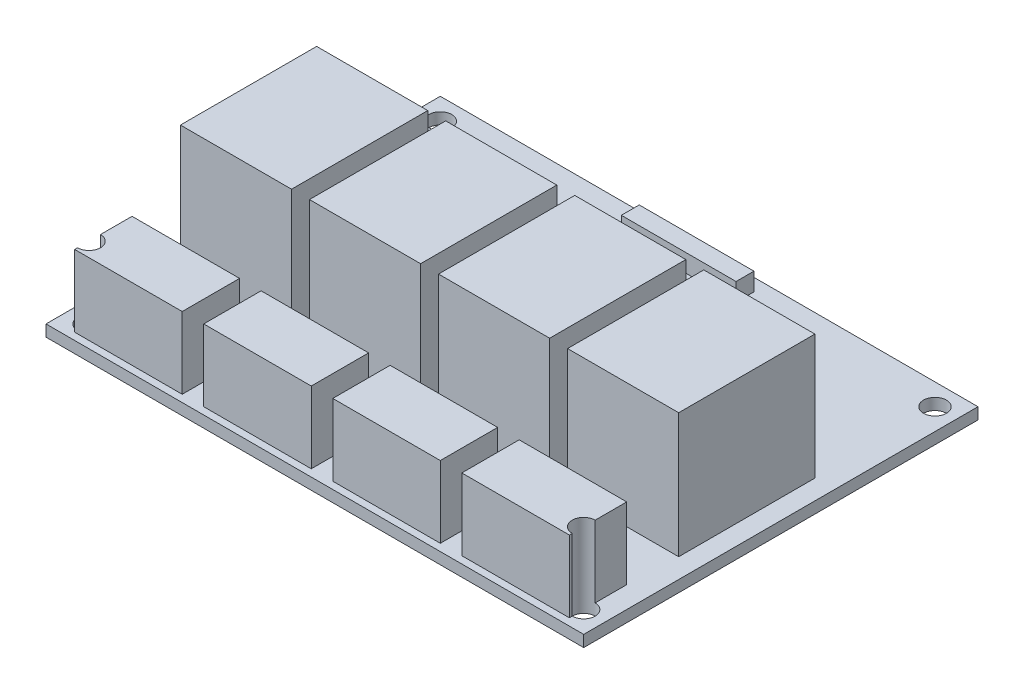
from build123d import *

# Parameters (mm, degrees)
SKETCH1_W              = 75
SKETCH1_H              = 55
PCB_DEPTH              = 1.6
RELAY_1_START          = 1.6
SKETCH2_W              = 15.5
SKETCH2_H              = 19
RELAY_1_DEPTH          = 17.4
TERMINAL_1_START       = 1.6
SKETCH3_W              = 15
SKETCH3_H              = 8
TERMINAL_1_DEPTH       = 10
RELAY_2_START          = 1.6
SKETCH4_W              = 15.5
SKETCH4_H              = 19
RELAY_2_DEPTH          = 17.4
TERMINAL_2_START       = 1.6
SKETCH5_W              = 15
SKETCH5_H              = 8
TERMINAL_2_DEPTH       = 10
RELAY_3_START          = 1.6
SKETCH6_W              = 15.5
SKETCH6_H              = 19
RELAY_3_DEPTH          = 17.4
TERMINAL_3_START       = 1.6
SKETCH7_W              = 15
SKETCH7_H              = 8
TERMINAL_3_DEPTH       = 10
RELAY_4_START          = 1.6
SKETCH8_W              = 15.5
SKETCH8_H              = 19
RELAY_4_DEPTH          = 17.4
TERMINAL_4_START       = 1.6
SKETCH9_W              = 15
SKETCH9_H              = 8
TERMINAL_4_DEPTH       = 10
HEADER_START           = 1.6
SKETCH10_W             = 16
SKETCH10_H             = 2.5
HEADER_DEPTH           = 2.5
MOUNT_HOLES_DEPTH      = 51.23445033
MOUNT_HOLES_DEPTH_BACK = 51.23445033
SKETCH11_R             = 1.6


with BuildPart() as part:
    # Sketch1 → PCB (new body)
    with BuildSketch(Plane(origin=(0, 0, 0), x_dir=(1, 0, 0), z_dir=(0, 1, 0))):
        Rectangle(SKETCH1_W, SKETCH1_H)
    extrude(amount=PCB_DEPTH)

    # Sketch2 → Relay_1 (add)
    with BuildSketch(Plane(origin=(0, 0, 0), x_dir=(1, 0, 0), z_dir=(0, 1, 0)).offset(RELAY_1_START)):
        with Locations((-27, -2)):
            Rectangle(SKETCH2_W, SKETCH2_H)
    extrude(amount=RELAY_1_DEPTH)

    # Sketch3 → Terminal_1 (add)
    with BuildSketch(Plane(origin=(0, 0, 0), x_dir=(1, 0, 0), z_dir=(0, 1, 0)).offset(TERMINAL_1_START)):
        with Locations((-27, -22.5)):
            Rectangle(SKETCH3_W, SKETCH3_H)
    extrude(amount=TERMINAL_1_DEPTH)

    # Sketch4 → Relay_2 (add)
    with BuildSketch(Plane(origin=(0, 0, 0), x_dir=(1, 0, 0), z_dir=(0, 1, 0)).offset(RELAY_2_START)):
        with Locations((-9, -2)):
            Rectangle(SKETCH4_W, SKETCH4_H)
    extrude(amount=RELAY_2_DEPTH)

    # Sketch5 → Terminal_2 (add)
    with BuildSketch(Plane(origin=(0, 0, 0), x_dir=(1, 0, 0), z_dir=(0, 1, 0)).offset(TERMINAL_2_START)):
        with Locations((-9, -22.5)):
            Rectangle(SKETCH5_W, SKETCH5_H)
    extrude(amount=TERMINAL_2_DEPTH)

    # Sketch6 → Relay_3 (add)
    with BuildSketch(Plane(origin=(0, 0, 0), x_dir=(1, 0, 0), z_dir=(0, 1, 0)).offset(RELAY_3_START)):
        with Locations((9, -2)):
            Rectangle(SKETCH6_W, SKETCH6_H)
    extrude(amount=RELAY_3_DEPTH)

    # Sketch7 → Terminal_3 (add)
    with BuildSketch(Plane(origin=(0, 0, 0), x_dir=(1, 0, 0), z_dir=(0, 1, 0)).offset(TERMINAL_3_START)):
        with Locations((9, -22.5)):
            Rectangle(SKETCH7_W, SKETCH7_H)
    extrude(amount=TERMINAL_3_DEPTH)

    # Sketch8 → Relay_4 (add)
    with BuildSketch(Plane(origin=(0, 0, 0), x_dir=(1, 0, 0), z_dir=(0, 1, 0)).offset(RELAY_4_START)):
        with Locations((27, -2)):
            Rectangle(SKETCH8_W, SKETCH8_H)
    extrude(amount=RELAY_4_DEPTH)

    # Sketch9 → Terminal_4 (add)
    with BuildSketch(Plane(origin=(0, 0, 0), x_dir=(1, 0, 0), z_dir=(0, 1, 0)).offset(TERMINAL_4_START)):
        with Locations((27, -22.5)):
            Rectangle(SKETCH9_W, SKETCH9_H)
    extrude(amount=TERMINAL_4_DEPTH)

    # Sketch10 → Header (add)
    with BuildSketch(Plane(origin=(0, 0, 0), x_dir=(1, 0, 0), z_dir=(0, 1, 0)).offset(HEADER_START)):
        with Locations((0, 24.5)):
            Rectangle(SKETCH10_W, SKETCH10_H)
    extrude(amount=HEADER_DEPTH)

    # Sketch11 → Mount_Holes (cut, two sides: drawn at the far end of the back side and taken through both)
    with BuildSketch(Plane(origin=(0, 0, 0), x_dir=(1, 0, 0), z_dir=(0, 1, 0)).offset(-MOUNT_HOLES_DEPTH_BACK)):
        with Locations(Location((-34.5, 24.5, 0), (0, 0, 90))):
            Circle(SKETCH11_R)
        with Locations(Location((-34.5, -24.5, 0), (0, 0, 270))):
            Circle(SKETCH11_R)
        with Locations(Location((34.5, 24.5, 0), (0, 0, 90))):
            Circle(SKETCH11_R)
        with Locations(Location((34.5, -24.5, 0), (0, 0, 270))):
            Circle(SKETCH11_R)
    extrude(amount=MOUNT_HOLES_DEPTH + MOUNT_HOLES_DEPTH_BACK, mode=Mode.SUBTRACT)


solid = part.part
